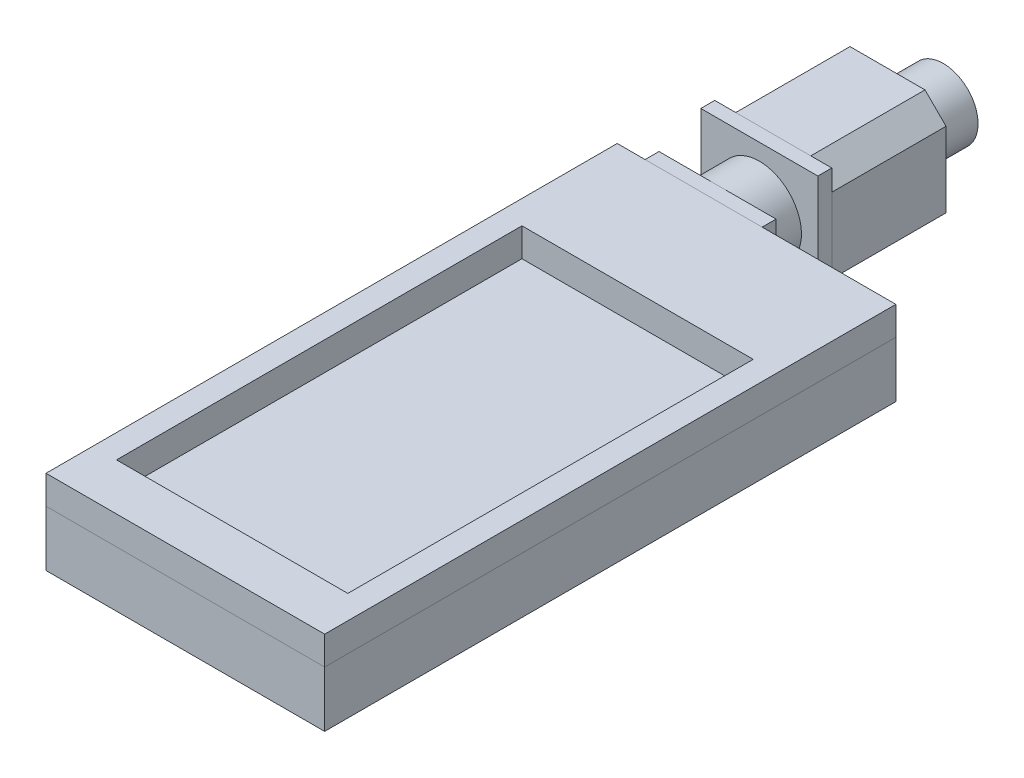
from build123d import *

# Parameters (mm, degrees)
SKETCH1_W           = 100
SKETCH1_H           = 205
SKETCH1_W_2         = 83
SKETCH1_H_2         = 145.5
BOSS_EXTRUDE1_DEPTH = 10.24
SKETCH2_W           = 100
SKETCH2_H           = 205
BOSS_EXTRUDE2_DEPTH = 20
SKETCH6_W           = 42
SKETCH6_H           = 30.24
BOSS_EXTRUDE4_DEPTH = 5
SKETCH7_R           = 15.12
BOSS_EXTRUDE5_DEPTH = 15
SKETCH8_W           = 42
SKETCH8_H           = 42
BOSS_EXTRUDE6_DEPTH = 5
BOSS_EXTRUDE7_DEPTH = 41
SKETCH10_R          = 12.5
BOSS_EXTRUDE8_DEPTH = 20
SKETCH12_R          = 3.05
CUT_EXTRUDE2_DEPTH  = 16


with BuildPart() as part:
    # Sketch1 → Boss-Extrude1 (new body)
    with BuildSketch(Plane(origin=(0, 0, 0), x_dir=(1, 0, 0), z_dir=(0, 1, 0))):
        Rectangle(SKETCH1_W, SKETCH1_H)
        with Locations((0, -12.94)):
            Rectangle(SKETCH1_W_2, SKETCH1_H_2, mode=Mode.SUBTRACT)
    extrude(amount=BOSS_EXTRUDE1_DEPTH)


with BuildPart() as body_2:
    # Sketch2 → Boss-Extrude2 (new body)
    with BuildSketch(Plane.XZ):
        Rectangle(SKETCH2_W, SKETCH2_H)
    extrude(amount=BOSS_EXTRUDE2_DEPTH)

    # Sketch12 → Cut-Extrude2 (cut)
    with BuildSketch(Plane.XZ.offset(20)):
        with Locations((25, 77.5)):
            Circle(SKETCH12_R)
        with Locations((25, -70.5)):
            Circle(SKETCH12_R)
        with Locations((-25, -70.5)):
            Circle(SKETCH12_R)
        with Locations((-25, 77.5)):
            Circle(SKETCH12_R)
    extrude(amount=-CUT_EXTRUDE2_DEPTH, mode=Mode.SUBTRACT)


with BuildPart() as body_3:
    # Sketch6 → Boss-Extrude4 (new body)
    with BuildSketch(Plane(origin=(0, 0, -102.5), x_dir=(-1, 0, 0), z_dir=(0, 0, -1))):
        with Locations((19, -4.88)):
            Rectangle(SKETCH6_W, SKETCH6_H)
    extrude(amount=BOSS_EXTRUDE4_DEPTH)

    # Sketch7 → Boss-Extrude5 (add)
    with BuildSketch(Plane(origin=(0, 0, -107.5), x_dir=(-1, 0, 0), z_dir=(0, 0, -1))):
        with Locations((19, -4.88)):
            Circle(SKETCH7_R)
    extrude(amount=BOSS_EXTRUDE5_DEPTH)

    # Sketch8 → Boss-Extrude6 (add)
    with BuildSketch(Plane(origin=(0, 0, -122.5), x_dir=(-1, 0, 0), z_dir=(0, 0, -1))):
        with Locations((19, -4.88)):
            Rectangle(SKETCH8_W, SKETCH8_H)
    extrude(amount=BOSS_EXTRUDE6_DEPTH)


with BuildPart() as body_4:
    # Sketch9 → Boss-Extrude7 (new body)
    with BuildSketch(Plane(origin=(0, 0, -127.5), x_dir=(-1, 0, 0), z_dir=(0, 0, -1))):
        Polygon((40, -18.340331321), (32.460331321, -25.88), (5.539668679, -25.88), (-2, -18.340331321), (-2, 8.580331321), (5.539668679, 16.12), (32.460331321, 16.12), (40, 8.580331321), align=None)
    extrude(amount=BOSS_EXTRUDE7_DEPTH)


with BuildPart() as body_5:
    # Sketch10 → Boss-Extrude8 (new body)
    with BuildSketch(Plane(origin=(0, 0, -168.5), x_dir=(-1, 0, 0), z_dir=(0, 0, -1))):
        with Locations((19, -4.88)):
            Circle(SKETCH10_R)
    extrude(amount=BOSS_EXTRUDE8_DEPTH)


solid = Compound([part.part, body_2.part, body_3.part, body_4.part, body_5.part])
